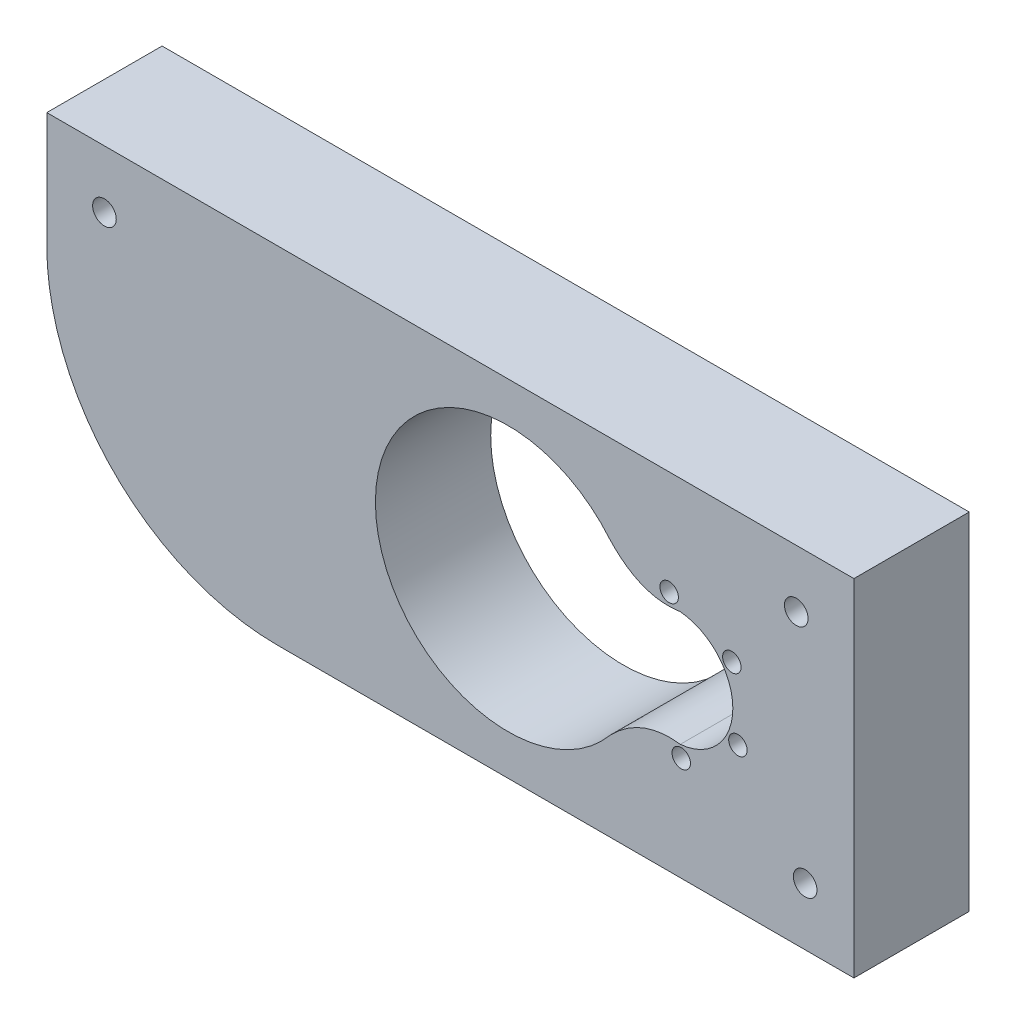
from build123d import *

# Parameters (mm, degrees)
ESQUISSE1_W             = 70
ESQUISSE1_H             = 30
BOSS_EXTRU_1_DEPTH      = 10
ESQUISSE2_R             = 0.8
ENL_V_MAT_EXTRU_1_DEPTH = 77.811457479
ESQUISSE3_R             = 1.025
ENL_V_MAT_EXTRU_2_DEPTH = 77.811457622
CONG_2_R                = 20


with BuildPart() as part:
    # Esquisse1 → Boss.-Extru.1 (new body)
    with BuildSketch(Plane.XY):
        with Locations((35, 15)):
            Rectangle(ESQUISSE1_W, ESQUISSE1_H)
    extrude(amount=BOSS_EXTRU_1_DEPTH)

    # Esquisse2 → Enlèv. mat.-Extru.1 (cut, through all)
    with BuildSketch(Plane.XY.offset(10)):
        with Locations((53.974554028, 20.976947928)):
            Circle(ESQUISSE2_R)
        with Locations((59.413465757, 18.443523524)):
            Circle(ESQUISSE2_R)
        with Locations((59.938911728, 12.466575596)):
            Circle(ESQUISSE2_R)
        with Locations((55.025445972, 9.023052072)):
            Circle(ESQUISSE2_R)
        with BuildLine():
            ThreePointArc((54.940833126, 19.980528702), (59.5, 15), (54.940833126, 10.019471298))
            add(Edge.make_bspline(
                [(48.86, 7.668533571), (51.540343022, 10.446024006), (54.940833126, 10.019471298)],
                knots=[0, 0, 0, 1, 1, 1], degree=2))
            ThreePointArc((48.86, 7.668533571), (28.5, 15), (48.86, 22.331466429))
            add(Edge.make_bspline(
                [(48.86, 22.331466429), (51.534478996, 19.459310032), (54.940833126, 19.980528702)],
                knots=[0, 0, 0, 1, 1, 1], degree=2))
        make_face()
    extrude(amount=-ENL_V_MAT_EXTRU_1_DEPTH, mode=Mode.SUBTRACT)

    # Esquisse3 → Enlèv. mat.-Extru.2 (cut, through all)
    with BuildSketch(Plane.XY.offset(10)):
        with Locations((5, 25)):
            Circle(ESQUISSE3_R)
        with Locations((65.771138483, 5)):
            Circle(ESQUISSE3_R)
        with Locations((65, 25)):
            Circle(ESQUISSE3_R)
    extrude(amount=-ENL_V_MAT_EXTRU_2_DEPTH, mode=Mode.SUBTRACT)

    # Congé2
    cong_2_edges = [part.edges().sort_by_distance(p)[0] for p in [
        (0, 0, 5),
    ]]
    fillet(cong_2_edges, radius=CONG_2_R)


solid = part.part
